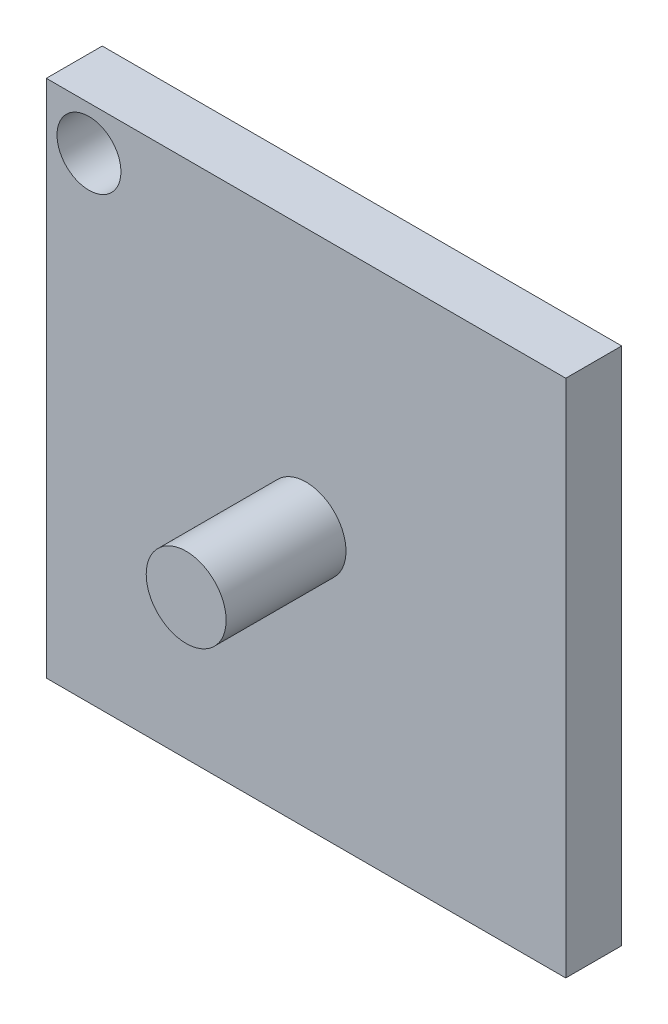
from build123d import *

# Parameters (mm, degrees)
SKETCH2_W           = 65
SKETCH2_H           = 65
BOSS_EXTRUDE1_DEPTH = 7
SKETCH3_R           = 5
BOSS_EXTRUDE2_DEPTH = 15
SKETCH4_R           = 4
CUT_EXTRUDE1_DEPTH  = 49.347699015


with BuildPart() as part:
    # Sketch2 → Boss-Extrude1 (new body)
    with BuildSketch(Plane.XY):
        Rectangle(SKETCH2_W, SKETCH2_H)
    extrude(amount=BOSS_EXTRUDE1_DEPTH)

    # Sketch3 → Boss-Extrude2 (add)
    with BuildSketch(Plane.XY.offset(7)):
        with Locations(Location((0, 0, 0), (0, 0, 180))):
            Circle(SKETCH3_R)
    extrude(amount=BOSS_EXTRUDE2_DEPTH)

    # Sketch4 → Cut-Extrude1 (cut, through all)
    with BuildSketch(Plane.XY.offset(7)):
        with Locations((-27.162431983, 27.037591963)):
            Circle(SKETCH4_R)
    extrude(amount=-CUT_EXTRUDE1_DEPTH, mode=Mode.SUBTRACT)


solid = part.part
